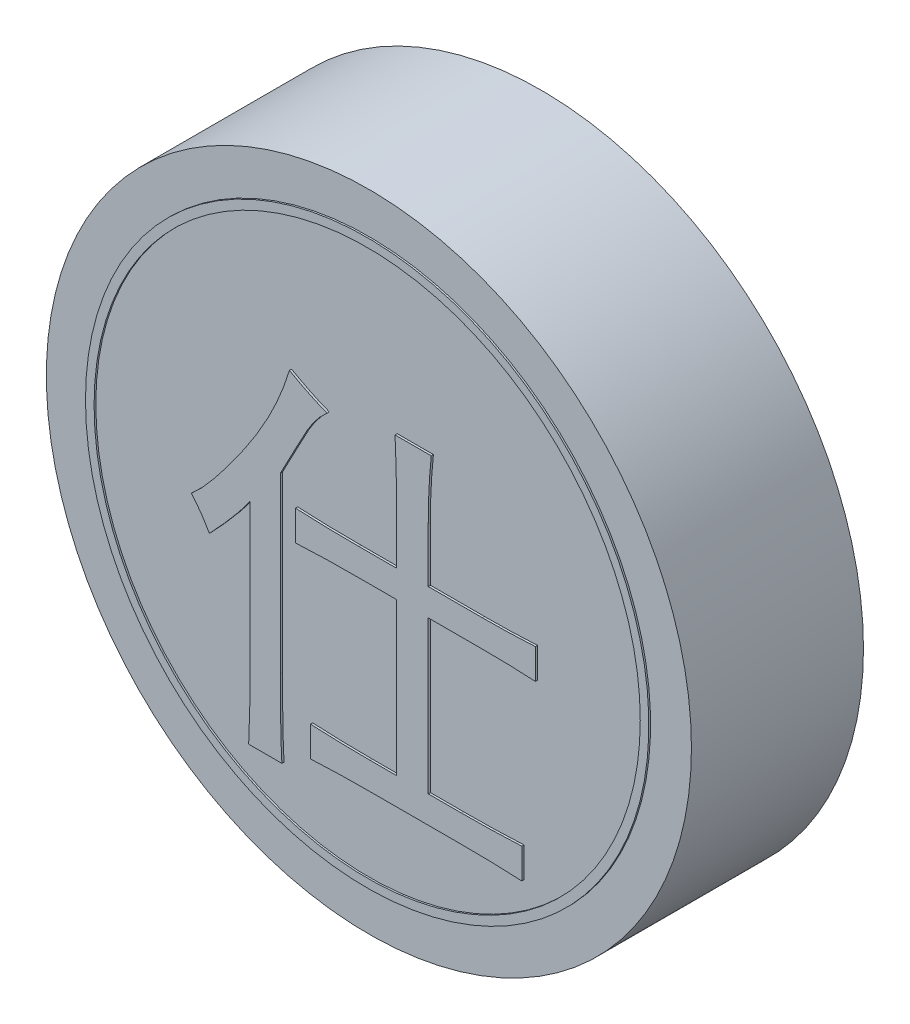
from build123d import *

# Parameters (mm, degrees)
SKETCH_1_R               = 15
DIAMETER30_HEIGHT8_DEPTH = 8
CHARACTER_DEPTH          = 0.1
SKETCH_3_R               = 13.1
SKETCH_3_R_2             = 12.7
INK_RING_DEPTH           = 0.08


with BuildPart() as part:
    # 草图1 → Diameter30_Height8 (new body)
    with BuildSketch(Plane.XY):
        Circle(SKETCH_1_R)
    extrude(amount=-DIAMETER30_HEIGHT8_DEPTH)

    # 草图2 → Character_仕 (add)
    with BuildSketch(Plane.XY):
        with BuildLine():
            Line((1.385964912, 0.48245614), (1.385964912, 3.078947368))
            add(Edge.make_bspline(
                [(1.385964912, 3.078947368), (1.382856556, 3.540795331), (1.376713677, 4.453520939), (1.335934161, 5.365353156), (1.315789474, 5.815789474)],
                knots=[0, 0, 0, 0, 1.012019295, 2, 2, 2, 2], degree=3))
            Line((1.315789474, 5.815789474), (3, 5.815789474))
            add(Edge.make_bspline(
                [(3, 5.815789474), (2.977495606, 5.590667791), (2.932023515, 5.135789802), (2.894778649, 4.442009997), (2.862268379, 3.73162247), (2.860528273, 3.251395934), (2.859649123, 3.00877193)],
                knots=[0, 0, 0, 0, 0.965427312, 1.950730062, 2.964650972, 4, 4, 4, 4], degree=3))
            Line((2.859649123, 3.00877193), (2.859649123, 0.48245614))
            Line((2.859649123, 0.48245614), (5.385964912, 0.48245614))
            add(Edge.make_bspline(
                [(5.385964912, 0.48245614), (5.612960978, 0.48353494), (6.051396179, 0.485618604), (6.68734214, 0.499259504), (7.279297852, 0.517890937), (7.659345282, 0.541350279), (7.842105263, 0.552631579)],
                knots=[0, 0, 0, 0, 1.108393509, 2.14082447, 3.105946107, 4, 4, 4, 4], degree=3))
            Line((7.842105263, 0.552631579), (7.842105263, -0.850877193))
            add(Edge.make_bspline(
                [(7.842105263, -0.850877193), (7.659345282, -0.839595893), (7.279297852, -0.816136551), (6.68734214, -0.797505118), (6.051396179, -0.783864218), (5.612960978, -0.781780554), (5.385964912, -0.780701754)],
                knots=[0, 0, 0, 0, 0.894053893, 1.85917553, 2.891606491, 4, 4, 4, 4], degree=3))
            Line((5.385964912, -0.780701754), (2.859649123, -0.780701754))
            Line((2.859649123, -0.780701754), (2.859649123, -7.868421053))
            Line((2.859649123, -7.868421053), (4.403508772, -7.868421053))
            add(Edge.make_bspline(
                [(4.403508772, -7.868421053), (4.663425226, -7.867326084), (5.166829886, -7.865205357), (5.894610336, -7.851761208), (6.570572064, -7.832958173), (7.00263653, -7.809522024), (7.210526316, -7.798245614)],
                knots=[0, 0, 0, 0, 1.110647855, 2.151096232, 3.11039153, 4, 4, 4, 4], degree=3))
            Line((7.210526316, -7.798245614), (7.210526316, -9.201754386))
            add(Edge.make_bspline(
                [(7.210526316, -9.201754386), (7.010437031, -9.190419998), (6.583606619, -9.166241483), (5.90326924, -9.148137401), (5.144305253, -9.134624919), (4.612310457, -9.132626772), (4.333333333, -9.131578947)],
                knots=[0, 0, 0, 0, 0.835449614, 1.782180905, 2.836979614, 4, 4, 4, 4], degree=3))
            Line((4.333333333, -9.131578947), (0.263157895, -9.131578947))
            add(Edge.make_bspline(
                [(0.263157895, -9.131578947), (-0.015819229, -9.132626772), (-0.547814025, -9.134624919), (-1.306778012, -9.148137401), (-1.987115391, -9.166241483), (-2.413945803, -9.190419998), (-2.614035088, -9.201754386)],
                knots=[0, 0, 0, 0, 1.163020386, 2.217819095, 3.164550386, 4, 4, 4, 4], degree=3))
            Line((-2.614035088, -9.201754386), (-2.614035088, -7.798245614))
            add(Edge.make_bspline(
                [(-2.614035088, -7.798245614), (-2.407878143, -7.809517208), (-1.981010451, -7.832856124), (-1.318910587, -7.851574268), (-0.61279286, -7.865227274), (-0.127579839, -7.86733394), (0.122807018, -7.868421053)],
                knots=[0, 0, 0, 0, 0.904818853, 1.873514066, 2.902659025, 4, 4, 4, 4], degree=3))
            Line((0.122807018, -7.868421053), (1.385964912, -7.868421053))
            Line((1.385964912, -7.868421053), (1.385964912, -0.780701754))
            Line((1.385964912, -0.780701754), (-0.298245614, -0.780701754))
            add(Edge.make_bspline(
                [(-0.298245614, -0.780701754), (-0.452461393, -0.780188061), (-0.752239456, -0.7791895), (-1.189731892, -0.786231443), (-1.603011279, -0.790357704), (-1.992035716, -0.797879868), (-2.356713286, -0.809539056), (-2.697351984, -0.817728412), (-3.014316789, -0.834938878), (-3.217890625, -0.845701458), (-3.315789474, -0.850877193)],
                knots=[0, 0, 0, 0, 1.226022714, 2.383249742, 3.478491498, 4.511863319, 5.476544353, 6.379262498, 7.220585815, 8, 8, 8, 8], degree=3))
            Line((-3.315789474, -0.850877193), (-3.315789474, 0.552631579))
            add(Edge.make_bspline(
                [(-3.315789474, 0.552631579), (-3.21875707, 0.547453703), (-3.016916501, 0.536683017), (-2.703415706, 0.519544836), (-2.367110401, 0.511265445), (-2.010227251, 0.49975938), (-1.630736813, 0.492055864), (-1.229584063, 0.488016267), (-0.805954579, 0.480955843), (-0.51657237, 0.481948131), (-0.368421053, 0.48245614)],
                knots=[0, 0, 0, 0, 0.790917863, 1.645216496, 2.555317213, 3.528854326, 4.55156314, 5.644660669, 6.794166974, 8, 8, 8, 8], degree=3))
            Line((-0.368421053, 0.48245614), (1.385964912, 0.48245614))
        make_face()
        with BuildLine():
            add(Edge.make_bspline(
                [(-1.842105263, 5.114035088), (-1.933851435, 5.029026304), (-2.117541902, 4.858825164), (-2.365563333, 4.57167672), (-2.591993254, 4.259206087), (-2.763277727, 3.974023896), (-2.899956693, 3.72227062), (-3.016573333, 3.503293196), (-3.149738899, 3.257168631), (-3.294556387, 2.980814576), (-3.455706316, 2.678049907), (-3.630506142, 2.346123327), (-3.820034881, 1.98606085), (-3.950103328, 1.735288634), (-4.01754386, 1.605263158)],
                knots=[0, 0, 0, 0, 1.083759172, 2.169858686, 3.283228111, 4.425909641, 5.051182283, 5.766997595, 6.57693099, 7.477449721, 8.472081343, 9.550673888, 10.730023607, 12, 12, 12, 12], degree=3))
            Line((-4.01754386, 1.605263158), (-4.01754386, -6.464912281))
            add(Edge.make_bspline(
                [(-4.01754386, -6.464912281), (-4.018056133, -6.65204931), (-4.019052245, -7.015935362), (-4.012047973, -7.545266441), (-4.007901436, -8.042578811), (-4.000400634, -8.506973521), (-3.988771218, -8.938370958), (-3.98063319, -9.336170915), (-3.963429216, -9.700804491), (-3.952560119, -9.932966081), (-3.947368421, -10.043859649)],
                knots=[0, 0, 0, 0, 1.25452393, 2.439409025, 3.548794241, 4.588568869, 5.552973603, 6.441898353, 7.255762113, 8, 8, 8, 8], degree=3))
            Line((-3.947368421, -10.043859649), (-5.49122807, -10.043859649))
            add(Edge.make_bspline(
                [(-5.49122807, -10.043859649), (-5.48604403, -9.933832078), (-5.4752279, -9.704267368), (-5.458045854, -9.34570061), (-5.449866698, -8.958296312), (-5.43824574, -8.54249494), (-5.430714946, -8.098893278), (-5.426551478, -7.626704474), (-5.419547466, -7.12596442), (-5.420541736, -6.782003967), (-5.421052632, -6.605263158)],
                knots=[0, 0, 0, 0, 0.768562205, 1.603550436, 2.504569286, 3.472060047, 4.505901887, 5.600100741, 6.766834584, 8, 8, 8, 8], degree=3))
            Line((-5.421052632, -6.605263158), (-5.421052632, -0.219298246))
            add(Edge.make_bspline(
                [(-5.421052632, -0.219298246), (-5.477100123, -0.297465115), (-5.593729665, -0.460122996), (-5.780061764, -0.708596832), (-5.986068105, -0.970387502), (-6.216160665, -1.241667605), (-6.462173545, -1.53007964), (-6.726721569, -1.832063458), (-7.014400911, -2.14414193), (-7.213381091, -2.355918188), (-7.315789474, -2.464912281)],
                knots=[0, 0, 0, 0, 0.784966074, 1.633440328, 2.534521274, 3.503196048, 4.536232569, 5.628408604, 6.779421952, 8, 8, 8, 8], degree=3))
            add(Edge.make_bspline(
                [(-7.315789474, -2.464912281), (-7.376217454, -2.360289355), (-7.496986321, -2.151194296), (-7.698613752, -1.847907954), (-7.919509238, -1.554794995), (-8.078179419, -1.366518997), (-8.157894737, -1.271929825)],
                knots=[0, 0, 0, 0, 0.990939877, 1.980451519, 2.985386235, 4, 4, 4, 4], degree=3))
            add(Edge.make_bspline(
                [(-8.157894737, -1.271929825), (-8.078444276, -1.200683827), (-7.908680075, -1.048450351), (-7.650883543, -0.790792829), (-7.380450508, -0.484210357), (-7.085685528, -0.139123391), (-6.774453616, 0.251552056), (-6.444928694, 0.686800589), (-6.093822829, 1.163741111), (-5.733795482, 1.678782143), (-5.373823069, 2.211324676), (-5.038729415, 2.753088359), (-4.729340369, 3.291388528), (-4.443634689, 3.826106433), (-4.193529603, 4.362171988), (-3.965829486, 4.893831939), (-3.764036827, 5.42296806), (-3.651942432, 5.779680656), (-3.596491228, 5.956140351)],
                knots=[0, 0, 0, 0, 0.593635041, 1.268437926, 2.026139621, 2.86729733, 3.793145817, 4.804357063, 5.904290477, 7.087660503, 8.300109294, 9.479773153, 10.630579527, 11.753876596, 12.851315059, 13.920229824, 14.971172829, 16, 16, 16, 16], degree=3))
            add(Edge.make_bspline(
                [(-3.596491228, 5.956140351), (-3.455102142, 5.876001082), (-3.172790986, 5.715987251), (-2.737023645, 5.499372043), (-2.295481279, 5.293961951), (-1.99346903, 5.174105332), (-1.842105263, 5.114035088)],
                knots=[0, 0, 0, 0, 1.001016569, 1.998726716, 2.996993449, 4, 4, 4, 4], degree=3))
        make_face()
    extrude(amount=CHARACTER_DEPTH)

    # 草图3 → Ink_ring (add)
    with BuildSketch(Plane.XY):
        with Locations(Location((0, 0, 0), (0, 0, 180))):
            Circle(SKETCH_3_R)
        with Locations(Location((0, 0, 0), (0, 0, 180))):
            Circle(SKETCH_3_R_2, mode=Mode.SUBTRACT)
    extrude(amount=INK_RING_DEPTH)


solid = part.part
